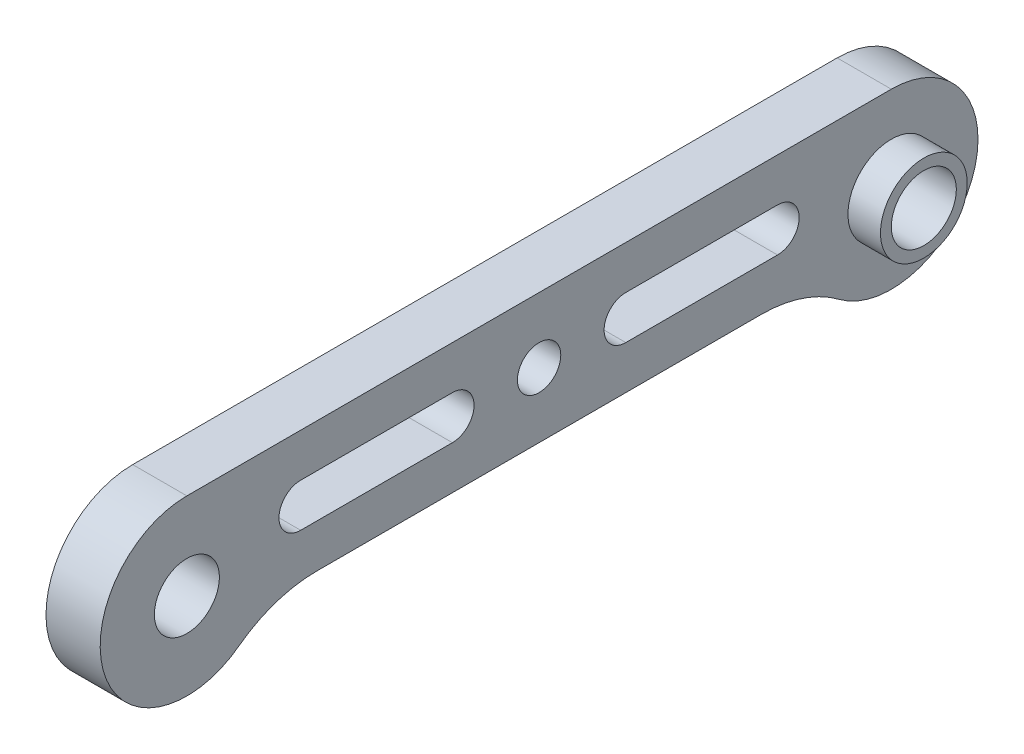
from build123d import *
from build123d.topology import SkipClean

# Parameters (mm, degrees)
SKETCH_1_R          = 3
EXTRUDE_1_DEPTH     = 5
FILLET_1_R          = 12
SKETCH_4_R          = 2
CUT_EXTRUDE_1_DEPTH = 5
EXTRUDE_START       = 3
SKETCH_5_R          = 4
SKETCH_5_R_2        = 3
EXTRUDE_2_DEPTH     = 3
EXTRUDE_START_2     = -5
SKETCH_5_2_R        = 4
SKETCH_5_2_R_2      = 3
EXTRUDE_3_DEPTH     = 3


with BuildPart() as part:
    # 草图1 → 凸台-拉伸1 (new body)
    with BuildSketch(Plane(origin=(0, 0, 0), x_dir=(0, 0, -1), z_dir=(1, 0, 0))):
        with BuildLine():
            Line((-6.92820323, -4), (-58.07179677, -4))
            ThreePointArc((-58.07179677, -4), (-71.92820323, -4), (-65, 8))
            Line((-65, 8), (0, 8))
            ThreePointArc((0, 8), (6.92820323, -4), (-6.92820323, -4))
        make_face()
        with Locations((-65, 0)):
            Circle(SKETCH_1_R, mode=Mode.SUBTRACT)
        Circle(SKETCH_1_R, mode=Mode.SUBTRACT)
    extrude(amount=EXTRUDE_1_DEPTH)

    # 圆角1
    fillet_1_edges = [part.edges().sort_by_distance(p)[0] for p in [
        (2.5, -4, 58.07179677),
        (2.5, -4, 6.92820323),
    ]]
    fillet(fillet_1_edges, radius=FILLET_1_R)

    # 草图4 → 切除-拉伸1 (cut)
    with BuildSketch(Plane(origin=(5, 0, 0), x_dir=(0, 0, -1), z_dir=(1, 0, 0))):
        with Locations((-32.5, 2)):
            Circle(SKETCH_4_R)
        with BuildLine():
            Line((-54.5, 4), (-40.5, 4))
            ThreePointArc((-40.5, 4), (-38.5, 2), (-40.5, 0))
            Line((-40.5, 0), (-54.5, 0))
            ThreePointArc((-54.5, 0), (-56.5, 2), (-54.5, 4))
        make_face()
        with BuildLine():
            Line((-24.5, 4), (-10.5, 4))
            ThreePointArc((-10.5, 4), (-8.5, 2), (-10.5, 0))
            Line((-10.5, 0), (-24.5, 0))
            ThreePointArc((-24.5, 0), (-26.5, 2), (-24.5, 4))
        make_face()
    extrude(amount=-CUT_EXTRUDE_1_DEPTH, mode=Mode.SUBTRACT)

    # 草图5 → 凸台-拉伸2 (add)
    with SkipClean():  # the faces are left unmerged after this step: merging them gives an invalid solid
        with BuildSketch(Plane.ZY.offset(EXTRUDE_START)):
            with Locations(Location((0, 0, 0), (0, 0, 180))):
                Circle(SKETCH_5_R)
            Circle(SKETCH_5_R_2, mode=Mode.SUBTRACT)
        extrude(amount=-EXTRUDE_2_DEPTH)

    # 草图5<2> → 凸台-拉伸3 (add)
    with BuildSketch(Plane.ZY.offset(EXTRUDE_START_2)):
        with Locations(Location((0, 0, 0), (0, 0, 180))):
            Circle(SKETCH_5_2_R)
        Circle(SKETCH_5_2_R_2, mode=Mode.SUBTRACT)
    extrude(amount=-EXTRUDE_3_DEPTH)


solid = part.part
